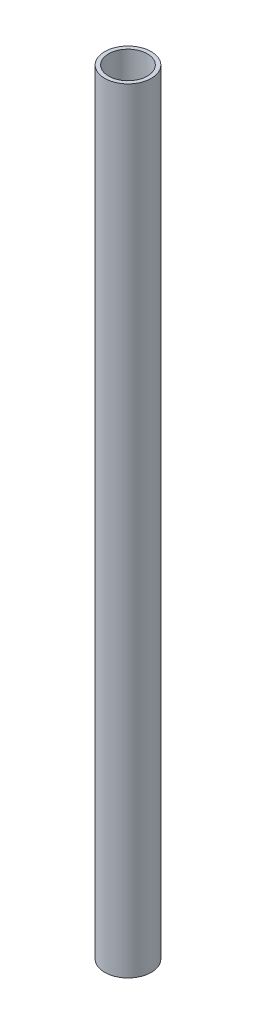
from build123d import *

# Parameters (mm, degrees)
SKETCH1_R           = 15
SKETCH1_R_2         = 12.5
BOSS_EXTRUDE1_DEPTH = 500


with BuildPart() as part:
    # Sketch1 → Boss-Extrude1 (new body)
    with BuildSketch(Plane(origin=(0, 0, 0), x_dir=(1, 0, 0), z_dir=(0, 1, 0))):
        with Locations(Location((0, 0, 0), (0, 0, 270))):
            Circle(SKETCH1_R)
        with Locations(Location((0, 0, 0), (0, 0, 270))):
            Circle(SKETCH1_R_2, mode=Mode.SUBTRACT)
    extrude(amount=BOSS_EXTRUDE1_DEPTH)


solid = part.part
